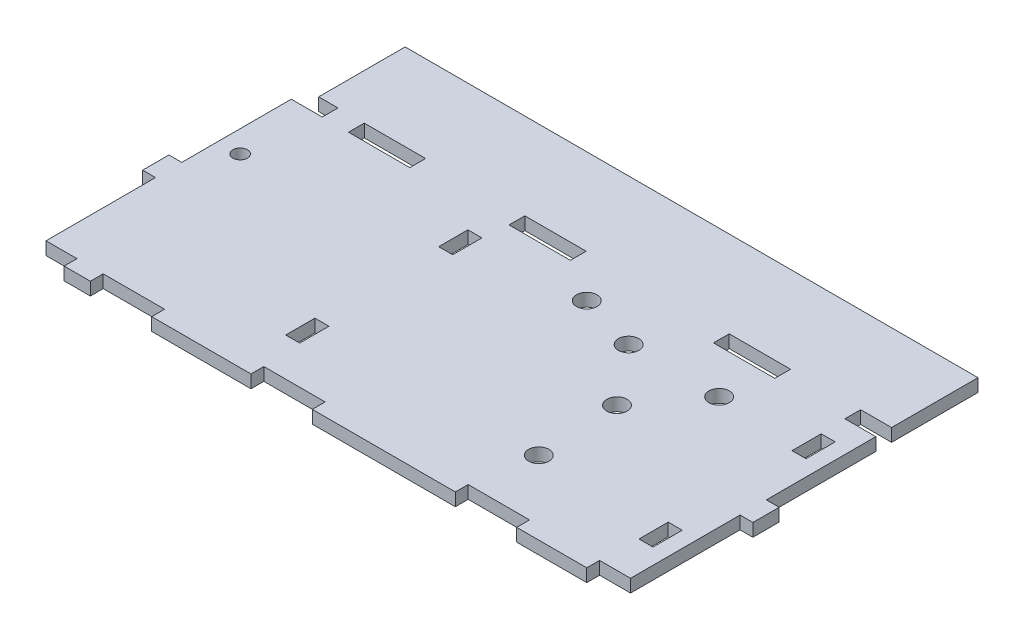
from build123d import *

# Parameters (mm, degrees)
SKETCH1_W           = 26.67
SKETCH1_H           = 6.858
BOSS_EXTRUDE1_DEPTH = 5.588
CUT_EXTRUDE1_REACH  = 184.177
SKETCH9_W           = 6.096
SKETCH9_H           = 12.7
CUT_EXTRUDE2_REACH  = 184.177
SKETCH12_R          = 3.175
CUT_EXTRUDE3_REACH  = 184.177
SKETCH13_R          = 4.445


with BuildPart() as part:
    # Sketch1 → Boss-Extrude1 (new body)
    with BuildSketch(Plane(origin=(0, 0, 0), x_dir=(1, 0, 0), z_dir=(0, 1, 0))):
        Polygon((-110.690062624, 12.380140685), (-116.278062624, 12.380140685), (-116.278062624, 0.950140685), (-110.690062624, 0.950140685), (-110.690062624, -46.674859251), (-97.228062624, -46.674859251), (-97.228062624, -52.262859251), (-85.798062624, -52.262859251), (-85.798062624, -46.674859251), (-59.128062624, -46.674859251), (-59.128062624, -52.262859251), (-15.948062624, -52.262859251), (-15.948062624, -46.674859251), (10.721937376, -46.674859251), (10.721937376, -52.262859251), (72.951937376, -52.262859251), (72.951937376, -46.674859251), (99.621937376, -46.674859251), (99.621937376, -52.262859251), (130.101937376, -52.262859251), (130.101937376, -46.67485938), (143.563937376, -46.67485938), (143.563937376, 0.950140682), (149.151937376, 0.950140682), (149.151937376, 12.38014062), (143.563937376, 12.38014062), (143.563937376, 60.00514062), (130.101937376, 60.00514062), (130.101937376, 66.86314062), (143.563937376, 66.86314062), (143.563937376, 104.45514062), (-105.610062624, 104.45514062), (-105.610062624, 66.86314062), (-97.228062624, 66.86314062), (-97.228062624, 60.00514062), (-110.690062624, 60.00514062), align=None)
        with Locations((-72.463062624, 63.43414062)):
            Rectangle(SKETCH1_W, SKETCH1_H, mode=Mode.SUBTRACT)
        with Locations((-2.613062624, 63.43414062)):
            Rectangle(SKETCH1_W, SKETCH1_H, mode=Mode.SUBTRACT)
        with Locations((86.286937376, 63.43414062)):
            Rectangle(SKETCH1_W, SKETCH1_H, mode=Mode.SUBTRACT)
    extrude(amount=BOSS_EXTRUDE1_DEPTH)

    # Sketch9 → Cut-Extrude1 (cut, up to next)
    with BuildSketch(Plane(origin=(0, 5.588, 0), x_dir=(1, 0, 0), z_dir=(0, 1, 0)), mode=Mode.PRIVATE) as cut_extrude1_sk1:
        with Locations((-20.012062624, -23.687859251)):
            Rectangle(SKETCH9_W, SKETCH9_H)
    cut_extrude1_tool1 = extrude(cut_extrude1_sk1.sketch, amount=-CUT_EXTRUDE1_REACH, mode=Mode.PRIVATE) & part.part
    # Sketch9 → Cut-Extrude1 (cut, up to next)
    with BuildSketch(Plane(origin=(0, 5.588, 0), x_dir=(1, 0, 0), z_dir=(0, 1, 0)), mode=Mode.PRIVATE) as cut_extrude1_sk2:
        with Locations((-20.012062624, 42.860140749)):
            Rectangle(SKETCH9_W, SKETCH9_H)
    cut_extrude1_tool2 = extrude(cut_extrude1_sk2.sketch, amount=-CUT_EXTRUDE1_REACH, mode=Mode.PRIVATE) & part.part
    # Sketch9 → Cut-Extrude1 (cut, up to next)
    with BuildSketch(Plane(origin=(0, 5.588, 0), x_dir=(1, 0, 0), z_dir=(0, 1, 0)), mode=Mode.PRIVATE) as cut_extrude1_sk3:
        with Locations((133.657937376, -23.687859251)):
            Rectangle(SKETCH9_W, SKETCH9_H)
    cut_extrude1_tool3 = extrude(cut_extrude1_sk3.sketch, amount=-CUT_EXTRUDE1_REACH, mode=Mode.PRIVATE) & part.part
    # Sketch9 → Cut-Extrude1 (cut, up to next)
    with BuildSketch(Plane(origin=(0, 5.588, 0), x_dir=(1, 0, 0), z_dir=(0, 1, 0)), mode=Mode.PRIVATE) as cut_extrude1_sk4:
        with Locations((133.657937376, 42.860140749)):
            Rectangle(SKETCH9_W, SKETCH9_H)
    cut_extrude1_tool4 = extrude(cut_extrude1_sk4.sketch, amount=-CUT_EXTRUDE1_REACH, mode=Mode.PRIVATE) & part.part
    add(cut_extrude1_tool1.solids().sort_by_distance((-20.012063, 5.588, 23.687859))[0], mode=Mode.SUBTRACT)
    add(cut_extrude1_tool2.solids().sort_by_distance((-20.012063, 5.588, -42.860141))[0], mode=Mode.SUBTRACT)
    add(cut_extrude1_tool3.solids().sort_by_distance((133.657937, 5.588, 23.687859))[0], mode=Mode.SUBTRACT)
    add(cut_extrude1_tool4.solids().sort_by_distance((133.657937, 5.588, -42.860141))[0], mode=Mode.SUBTRACT)

    # Sketch12 → Cut-Extrude2 (cut, up to next)
    with BuildSketch(Plane(origin=(0, 5.588, 0), x_dir=(1, 0, 0), z_dir=(0, 1, 0)), mode=Mode.PRIVATE) as cut_extrude2_sk1:
        with Locations(Location((-101.165062624, 28.25514062, 0), (0, 0, 270))):
            Circle(SKETCH12_R)
    cut_extrude2_tool1 = extrude(cut_extrude2_sk1.sketch, amount=-CUT_EXTRUDE2_REACH, mode=Mode.PRIVATE) & part.part
    add(cut_extrude2_tool1.solids().sort_by_distance((-101.165063, 5.588, -28.255141))[0], mode=Mode.SUBTRACT)

    # Sketch13 → Cut-Extrude3 (cut, up to next)
    with BuildSketch(Plane.XZ, mode=Mode.PRIVATE) as cut_extrude3_sk1:
        with Locations(Location((77.273937376, 20.297859251, 0), (0, 0, 270))):
            Circle(SKETCH13_R)
    cut_extrude3_tool1 = extrude(cut_extrude3_sk1.sketch, amount=-CUT_EXTRUDE3_REACH, mode=Mode.PRIVATE) & part.part
    # Sketch13 → Cut-Extrude3 (cut, up to next)
    with BuildSketch(Plane.XZ, mode=Mode.PRIVATE) as cut_extrude3_sk2:
        with Locations(Location((55.099783131, -40.95514062, 0), (0, 0, 270))):
            Circle(SKETCH13_R)
    cut_extrude3_tool2 = extrude(cut_extrude3_sk2.sketch, amount=-CUT_EXTRUDE3_REACH, mode=Mode.PRIVATE) & part.part
    # Sketch13 → Cut-Extrude3 (cut, up to next)
    with BuildSketch(Plane.XZ, mode=Mode.PRIVATE) as cut_extrude3_sk3:
        with Locations(Location((94.474354319, -40.95514062, 0), (0, 0, 270))):
            Circle(SKETCH13_R)
    cut_extrude3_tool3 = extrude(cut_extrude3_sk3.sketch, amount=-CUT_EXTRUDE3_REACH, mode=Mode.PRIVATE) & part.part
    # Sketch13 → Cut-Extrude3 (cut, up to next)
    with BuildSketch(Plane.XZ, mode=Mode.PRIVATE) as cut_extrude3_sk4:
        with Locations(Location((75.424354319, -15.55514062, 0), (0, 0, 270))):
            Circle(SKETCH13_R)
    cut_extrude3_tool4 = extrude(cut_extrude3_sk4.sketch, amount=-CUT_EXTRUDE3_REACH, mode=Mode.PRIVATE) & part.part
    # Sketch13 → Cut-Extrude3 (cut, up to next)
    with BuildSketch(Plane.XZ, mode=Mode.PRIVATE) as cut_extrude3_sk5:
        with Locations(Location((29.478937376, -48.367787821, 0), (0, 0, 270))):
            Circle(SKETCH13_R)
    cut_extrude3_tool5 = extrude(cut_extrude3_sk5.sketch, amount=-CUT_EXTRUDE3_REACH, mode=Mode.PRIVATE) & part.part
    add(cut_extrude3_tool1.solids().sort_by_distance((77.273937, 0, 20.297859))[0], mode=Mode.SUBTRACT)
    add(cut_extrude3_tool2.solids().sort_by_distance((55.099783, 0, -40.955141))[0], mode=Mode.SUBTRACT)
    add(cut_extrude3_tool3.solids().sort_by_distance((94.474354, 0, -40.955141))[0], mode=Mode.SUBTRACT)
    add(cut_extrude3_tool4.solids().sort_by_distance((75.424354, 0, -15.555141))[0], mode=Mode.SUBTRACT)
    add(cut_extrude3_tool5.solids().sort_by_distance((29.478937, 0, -48.367788))[0], mode=Mode.SUBTRACT)


solid = part.part
